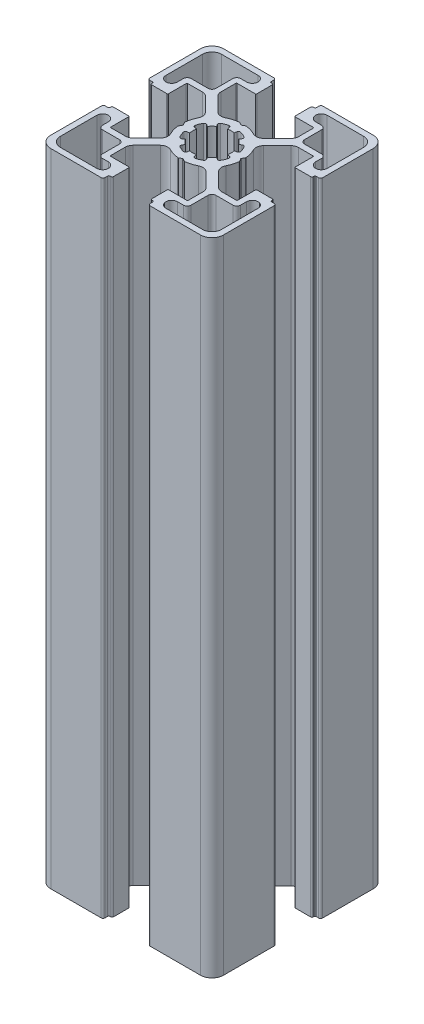
from build123d import *

# Parameters (mm, degrees)
BOSS_EXTRUDE1_DEPTH = 167


with BuildPart() as part:
    # Sketch1 → Boss-Extrude1 (new body)
    with BuildSketch(Plane(origin=(0, 0, 0), x_dir=(1, 0, 0), z_dir=(0, 1, 0))):
        with BuildLine():
            Line((7.563483841, 5.858695924), (11.129779796, 9.424987881))
            ThreePointArc((11.129779796, 9.424987881), (11.76062452, 9.846504465), (12.504756421, 9.994521395))
            Line((12.504756421, 9.994521395), (16.316902359, 9.994521395))
            ThreePointArc((16.316902359, 9.994521395), (16.458323963, 9.935942648), (16.51690271, 9.794521044))
            Line((16.51690271, 9.794521044), (16.51690271, 5.20001408))
            ThreePointArc((16.51690271, 5.20001408), (16.575481456, 5.058592476), (16.716903061, 5.000013729))
            Line((16.716903061, 5.000013729), (20.719599813, 5.000013729))
            ThreePointArc((20.719599813, 5.000013729), (20.931731335, 5.087881483), (21.019599089, 5.300013005))
            Line((21.019599089, 5.300013005), (21.019599089, 5.500003954))
            ThreePointArc((21.019599089, 5.500003954), (21.107466988, 5.71213583), (21.319598864, 5.800003729))
            Line((21.319598864, 5.800003729), (21.999979422, 5.800003729))
            ThreePointArc((21.999979422, 5.800003729), (22.353532548, 5.946450229), (22.499979048, 6.300003356))
            Line((22.499979048, 6.300003356), (22.499979048, 19.500015971))
            ThreePointArc((22.499979048, 19.500015971), (21.621300048, 21.62133473), (19.499981289, 22.50001373))
            Line((19.499981289, 22.50001373), (6.37570892, 22.50001373))
            ThreePointArc((6.37570892, 22.50001373), (6.022155794, 22.35356723), (5.875709294, 22.000014103))
            Line((5.875709294, 22.000014103), (5.875709294, 21.300013005))
            ThreePointArc((5.875709294, 21.300013005), (5.78784154, 21.087881482), (5.575710018, 21.000013729))
            Line((5.575710018, 21.000013729), (5.299998684, 21.000013729))
            ThreePointArc((5.299998684, 21.000013729), (5.087867516, 20.912146122), (4.999999909, 20.700014953))
            Line((4.999999909, 20.700014953), (4.999999909, 16.666812288))
            ThreePointArc((4.999999909, 16.666812288), (5.058578802, 16.52539033), (5.20000076, 16.466811437))
            Line((5.20000076, 16.466811437), (9.905385127, 16.466811437))
            ThreePointArc((9.905385127, 16.466811437), (10.046806731, 16.408232691), (10.105385478, 16.266811086))
            Line((10.105385478, 16.266811086), (10.105385478, 12.471582811))
            ThreePointArc((10.105385478, 12.471582811), (9.953144497, 11.706215717), (9.519598864, 11.057368824))
            Line((9.519598864, 11.057368824), (5.944897897, 7.482667857))
            ThreePointArc((5.944897897, 7.482667857), (4.854602604, 6.96783564), (3.666501718, 7.17329201))
            ThreePointArc((3.666501718, 7.17329201), (2.308631207, 7.714000899), (0.875344921, 8.000128222))
            ThreePointArc((0.875344921, 8.000128222), (0.813048151, 7.996979672), (0.754751151, 7.974792726))
            Line((0.754751151, 7.974792726), (0.112630526, 7.606936313))
            ThreePointArc((0.112630526, 7.606936313), (0.062965968, 7.559088119), (2.065e-06, 7.530953356))
            ThreePointArc((2.065e-06, 7.530953356), (-0.062961837, 7.559088119), (-0.112626394, 7.606936313))
            Line((-0.112626394, 7.606936313), (-0.754745572, 7.974791896))
            ThreePointArc((-0.754745572, 7.974791896), (-0.813042564, 7.99697884), (-0.875339325, 8.000127394))
            ThreePointArc((-0.875339325, 8.000127394), (-2.308625867, 7.714000103), (-3.666496612, 7.173291142))
            ThreePointArc((-3.666496612, 7.173291142), (-4.854599203, 6.967834938), (-5.944895348, 7.482669215))
            Line((-5.944895348, 7.482669215), (-9.519596331, 11.057370197))
            ThreePointArc((-9.519596331, 11.057370197), (-9.953141964, 11.70621709), (-10.105382945, 12.471584185))
            Line((-10.105382945, 12.471584185), (-10.105382945, 16.266811086))
            ThreePointArc((-10.105382945, 16.266811086), (-10.046804198, 16.408232691), (-9.905382594, 16.466811437))
            Line((-9.905382594, 16.466811437), (-5.200000942, 16.466811437))
            ThreePointArc((-5.200000942, 16.466811437), (-5.058578984, 16.52539033), (-5.000000091, 16.666812288))
            Line((-5.000000091, 16.666812288), (-5.000000091, 20.700014953))
            ThreePointArc((-5.000000091, 20.700014953), (-5.087867699, 20.912146122), (-5.299998867, 21.000013729))
            Line((-5.299998867, 21.000013729), (-5.575710202, 21.000013729))
            ThreePointArc((-5.575710202, 21.000013729), (-5.787841724, 21.087881482), (-5.875709478, 21.300013005))
            Line((-5.875709478, 21.300013005), (-5.875709478, 22.000014104))
            ThreePointArc((-5.875709478, 22.000014104), (-6.022155978, 22.35356723), (-6.375709104, 22.50001373))
            Line((-6.375709104, 22.50001373), (-19.499981473, 22.50001373))
            ThreePointArc((-19.499981473, 22.50001373), (-21.621300232, 21.62133473), (-22.499979232, 19.500015971))
            Line((-22.499979232, 19.500015971), (-22.499979232, 6.300003356))
            ThreePointArc((-22.499979232, 6.300003356), (-22.353532732, 5.946450229), (-21.999979605, 5.800003729))
            Line((-21.999979605, 5.800003729), (-21.319599047, 5.800003729))
            ThreePointArc((-21.319599047, 5.800003729), (-21.107467171, 5.71213583), (-21.019599271, 5.500003954))
            Line((-21.019599271, 5.500003954), (-21.019599271, 5.300013005))
            ThreePointArc((-21.019599271, 5.300013005), (-20.931731518, 5.087881483), (-20.719599995, 5.000013729))
            Line((-20.719599995, 5.000013729), (-16.716903244, 5.000013729))
            ThreePointArc((-16.716903244, 5.000013729), (-16.57548164, 5.058592476), (-16.516902894, 5.20001408))
            Line((-16.516902894, 5.20001408), (-16.516902894, 9.794521044))
            ThreePointArc((-16.516902894, 9.794521044), (-16.458324147, 9.935942648), (-16.316902543, 9.994521395))
            Line((-16.316902543, 9.994521395), (-12.504755574, 9.994521395))
            ThreePointArc((-12.504755574, 9.994521395), (-11.760623673, 9.846504465), (-11.129778949, 9.424987881))
            Line((-11.129778949, 9.424987881), (-7.563484024, 5.858696956))
            ThreePointArc((-7.563484024, 5.858696956), (-7.018857309, 4.793955357), (-7.200363541, 3.611860429))
            ThreePointArc((-7.200363541, 3.611860429), (-7.719534914, 2.299057702), (-7.999860794, 0.915436613))
            ThreePointArc((-7.999860794, 0.915436613), (-7.996805132, 0.851929863), (-7.97397167, 0.792591196))
            Line((-7.97397167, 0.792591196), (-7.540055962, 0.046829926))
            ThreePointArc((-7.540055962, 0.046829926), (-7.534291471, 0.023676009), (-7.531325428, 3.7e-07))
            ThreePointArc((-7.531325428, 3.7e-07), (-7.534291471, -0.023675268), (-7.540055962, -0.046829185))
            Line((-7.540055962, -0.046829185), (-7.97397167, -0.792590455))
            ThreePointArc((-7.97397167, -0.792590455), (-7.996805132, -0.851929122), (-7.999860794, -0.915435872))
            ThreePointArc((-7.999860794, -0.915435872), (-7.719534914, -2.299056961), (-7.200363541, -3.611859688))
            ThreePointArc((-7.200363541, -3.611859688), (-7.018857309, -4.793954616), (-7.563484024, -5.858696215))
            Line((-7.563484024, -5.858696215), (-11.12977998, -9.424988171))
            ThreePointArc((-11.12977998, -9.424988171), (-11.760624704, -9.846504756), (-12.504756605, -9.994521685))
            Line((-12.504756605, -9.994521685), (-16.316902543, -9.994521685))
            ThreePointArc((-16.316902543, -9.994521685), (-16.458324147, -9.935942938), (-16.516902894, -9.794521334))
            Line((-16.516902894, -9.794521334), (-16.516902894, -5.200014371))
            ThreePointArc((-16.516902894, -5.200014371), (-16.57548164, -5.058592767), (-16.716903244, -5.000014021))
            Line((-16.716903244, -5.000014021), (-20.719599995, -5.000014021))
            ThreePointArc((-20.719599995, -5.000014021), (-20.931731518, -5.087881774), (-21.019599271, -5.300013296))
            Line((-21.019599271, -5.300013296), (-21.019599271, -5.500004245))
            ThreePointArc((-21.019599271, -5.500004245), (-21.107467171, -5.71213612), (-21.319599047, -5.80000402))
            Line((-21.319599047, -5.80000402), (-21.999979605, -5.80000402))
            ThreePointArc((-21.999979605, -5.80000402), (-22.353532732, -5.94645052), (-22.499979232, -6.300003647))
            Line((-22.499979232, -6.300003647), (-22.499979232, -19.500016261))
            ThreePointArc((-22.499979232, -19.500016261), (-21.621300232, -21.62133502), (-19.499981473, -22.50001402))
            Line((-19.499981473, -22.50001402), (-6.375709104, -22.50001402))
            ThreePointArc((-6.375709104, -22.50001402), (-6.022155978, -22.35356752), (-5.875709478, -22.000014394))
            Line((-5.875709478, -22.000014394), (-5.875709478, -21.300013295))
            ThreePointArc((-5.875709478, -21.300013295), (-5.787841724, -21.087881773), (-5.575710202, -21.000014019))
            Line((-5.575710202, -21.000014019), (-5.299998867, -21.000014019))
            ThreePointArc((-5.299998867, -21.000014019), (-5.087867699, -20.912146412), (-5.000000091, -20.700015244))
            Line((-5.000000091, -20.700015244), (-5.000000091, -16.666812578))
            ThreePointArc((-5.000000091, -16.666812578), (-5.058578984, -16.52539062), (-5.200000942, -16.466811727))
            Line((-5.200000942, -16.466811727), (-9.905382594, -16.466811727))
            ThreePointArc((-9.905382594, -16.466811727), (-10.046804198, -16.40823298), (-10.105382945, -16.266811376))
            Line((-10.105382945, -16.266811376), (-10.105382945, -12.471581681))
            ThreePointArc((-10.105382945, -12.471581681), (-9.953141964, -11.706214586), (-9.519596331, -11.057367693))
            Line((-9.519596331, -11.057367693), (-5.944895364, -7.482666726))
            ThreePointArc((-5.944895364, -7.482666726), (-4.854601518, -6.967832762), (-3.66650075, -7.173286521))
            ThreePointArc((-3.66650075, -7.173286521), (-2.30862839, -7.713996836), (-0.875339942, -8.000124808))
            ThreePointArc((-0.875339942, -8.000124808), (-0.81304361, -7.99697628), (-0.754747019, -7.97478949))
            Line((-0.754747019, -7.97478949), (-0.112626395, -7.606933078))
            ThreePointArc((-0.112626395, -7.606933078), (-0.062961838, -7.559084884), (2.065e-06, -7.530950121))
            ThreePointArc((2.065e-06, -7.530950121), (0.062965968, -7.559084884), (0.112630526, -7.606933078))
            Line((0.112630526, -7.606933078), (0.754751151, -7.974789491))
            ThreePointArc((0.754751151, -7.974789491), (0.813048151, -7.996976437), (0.875344921, -8.000124987))
            ThreePointArc((0.875344921, -8.000124987), (2.308629801, -7.71399808), (3.666499103, -7.173290103))
            ThreePointArc((3.666499103, -7.173290103), (4.854601719, -6.967833865), (5.944897897, -7.482668146))
            Line((5.944897897, -7.482668146), (9.519598864, -11.057369113))
            ThreePointArc((9.519598864, -11.057369113), (9.953144497, -11.706216006), (10.105385478, -12.471583101))
            Line((10.105385478, -12.471583101), (10.105385478, -16.266811376))
            ThreePointArc((10.105385478, -16.266811376), (10.046806731, -16.40823298), (9.905385127, -16.466811727))
            Line((9.905385127, -16.466811727), (5.20000076, -16.466811727))
            ThreePointArc((5.20000076, -16.466811727), (5.058578802, -16.52539062), (4.999999909, -16.666812578))
            Line((4.999999909, -16.666812578), (4.999999909, -20.700015244))
            ThreePointArc((4.999999909, -20.700015244), (5.087867516, -20.912146412), (5.299998684, -21.000014019))
            Line((5.299998684, -21.000014019), (5.575710018, -21.000014019))
            ThreePointArc((5.575710018, -21.000014019), (5.78784154, -21.087881773), (5.875709294, -21.300013295))
            Line((5.875709294, -21.300013295), (5.875709294, -22.000014394))
            ThreePointArc((5.875709294, -22.000014394), (6.022155794, -22.35356752), (6.37570892, -22.50001402))
            Line((6.37570892, -22.50001402), (19.499981289, -22.50001402))
            ThreePointArc((19.499981289, -22.50001402), (21.621300048, -21.62133502), (22.499979048, -19.500016261))
            Line((22.499979048, -19.500016261), (22.499979048, -6.300003646))
            ThreePointArc((22.499979048, -6.300003646), (22.353532548, -5.94645052), (21.999979422, -5.80000402))
            Line((21.999979422, -5.80000402), (21.319598864, -5.80000402))
            ThreePointArc((21.319598864, -5.80000402), (21.107466988, -5.71213612), (21.019599089, -5.500004245))
            Line((21.019599089, -5.500004245), (21.019599089, -5.300013297))
            ThreePointArc((21.019599089, -5.300013297), (20.931731335, -5.087881774), (20.719599813, -5.000014021))
            Line((20.719599813, -5.000014021), (16.716903061, -5.000014021))
            ThreePointArc((16.716903061, -5.000014021), (16.575481456, -5.058592767), (16.51690271, -5.200014371))
            Line((16.51690271, -5.200014371), (16.51690271, -9.794521334))
            ThreePointArc((16.51690271, -9.794521334), (16.458323963, -9.935942938), (16.316902359, -9.994521685))
            Line((16.316902359, -9.994521685), (12.504756421, -9.994521685))
            ThreePointArc((12.504756421, -9.994521685), (11.76062452, -9.846504756), (11.129779797, -9.424988171))
            Line((11.129779797, -9.424988171), (7.56348384, -5.858696215))
            ThreePointArc((7.56348384, -5.858696215), (7.018857125, -4.793954616), (7.200363357, -3.611859689))
            ThreePointArc((7.200363357, -3.611859689), (7.71953473, -2.299056961), (7.99986061, -0.915435872))
            ThreePointArc((7.99986061, -0.915435872), (7.996804948, -0.851929122), (7.973971486, -0.792590456))
            Line((7.973971486, -0.792590456), (7.54005578, -0.046829188))
            ThreePointArc((7.54005578, -0.046829188), (7.53429135, -0.023675779), (7.531325245, -6.6e-07))
            ThreePointArc((7.531325245, -6.6e-07), (7.534291289, 0.023674979), (7.54005578, 0.046828898))
            Line((7.54005578, 0.046828898), (7.973971486, 0.792590166))
            ThreePointArc((7.973971486, 0.792590166), (7.996804949, 0.851928832), (7.99986061, 0.915435582))
            ThreePointArc((7.99986061, 0.915435582), (7.719534731, 2.299056671), (7.200363358, 3.611859399))
            ThreePointArc((7.200363358, 3.611859399), (7.018857126, 4.793954326), (7.563483841, 5.858695924))
        make_face()
        with BuildLine():
            Line((-17.99997923, 9.000204729), (-17.99997923, 10.550013476))
            ThreePointArc((-17.99997923, 10.550013476), (-17.70708623, 11.257119729), (-16.999979977, 11.550012729))
            Line((-16.999979977, 11.550012729), (-12.549977483, 11.550012729))
            ThreePointArc((-12.549977483, 11.550012729), (-11.84287123, 11.842905729), (-11.54997823, 12.550011982))
            Line((-11.54997823, 12.550011982), (-11.54997823, 17.000014476))
            ThreePointArc((-11.54997823, 17.000014476), (-11.25708523, 17.707120729), (-10.549978977, 18.000013729))
            Line((-10.549978977, 18.000013729), (-8.99997923, 18.000013729))
            ThreePointArc((-8.99997923, 18.000013729), (-7.49997923, 19.500013729), (-8.99997923, 21.000013729))
            Line((-8.99997923, 21.000013729), (-18.499981098, 21.000013729))
            ThreePointArc((-18.499981098, 21.000013729), (-20.26774673, 20.267781229), (-20.99997923, 18.500015597))
            Line((-20.99997923, 18.500015597), (-20.99997923, 9.000204729))
            ThreePointArc((-20.99997923, 9.000204729), (-19.49997923, 7.500204729), (-17.99997923, 9.000204729))
        make_face(mode=Mode.SUBTRACT)
        with BuildLine():
            Line((0.967518273, 5.481094418), (0.867385333, 4.924170439))
            ThreePointArc((0.867385333, 4.924170439), (-3.404e-06, 4.999981493), (-0.867392141, 4.924170439))
            Line((-0.867392141, 4.924170439), (-0.967525085, 5.48109443))
            ThreePointArc((-0.967525085, 5.48109443), (-1.18787304, 5.829596016), (-1.595121059, 5.894060173))
            ThreePointArc((-1.595121059, 5.894060173), (-2.337474987, 5.644060679), (-3.0416713, 5.300991221))
            ThreePointArc((-3.0416713, 5.300991221), (-3.284300912, 4.965857552), (-3.191387249, 4.562681715))
            Line((-3.191387249, 4.562681715), (-2.864003826, 4.098457013))
            ThreePointArc((-2.864003826, 4.098457013), (-3.530136355, 3.540908116), (-4.089716295, 2.876480837))
            Line((-4.089716295, 2.876480837), (-4.566781049, 3.208143991))
            ThreePointArc((-4.566781049, 3.208143991), (-4.968981864, 3.298752353), (-5.302521511, 3.056416481))
            ThreePointArc((-5.302521511, 3.056416481), (-5.650679971, 2.354692469), (-5.906040083, 1.614137194))
            ThreePointArc((-5.906040083, 1.614137194), (-5.840630787, 1.205603075), (-5.48985103, 0.986212864))
            Line((-5.48985103, 0.986212864), (-4.920549171, 0.887804317))
            ThreePointArc((-4.920549171, 0.887804317), (-5.000003405, -1.8509e-05), (-4.92054917, -0.887841334))
            Line((-4.92054917, -0.887841334), (-5.48973413, -0.986229672))
            ThreePointArc((-5.48973413, -0.986229672), (-5.84059179, -1.205595835), (-5.906027737, -1.614179668))
            ThreePointArc((-5.906027737, -1.614179668), (-5.650660878, -2.354735576), (-5.302495324, -3.056459191))
            ThreePointArc((-5.302495324, -3.056459191), (-4.968965627, -3.298777294), (-4.566781049, -3.208181006))
            Line((-4.566781049, -3.208181006), (-4.089716295, -2.876517852))
            ThreePointArc((-4.089716295, -2.876517852), (-3.530136355, -3.540945131), (-2.864003826, -4.098494028))
            Line((-2.864003826, -4.098494028), (-3.191315305, -4.562616715))
            ThreePointArc((-3.191315305, -4.562616715), (-3.284288314, -4.9658247), (-3.041645074, -5.301003633))
            ThreePointArc((-3.041645074, -5.301003633), (-2.337436005, -5.644074141), (-1.595068803, -5.894071587))
            ThreePointArc((-1.595068803, -5.894071587), (-1.187863583, -5.829591875), (-0.967525085, -5.481131446))
            Line((-0.967525085, -5.481131446), (-0.867392142, -4.924207454))
            ThreePointArc((-0.867392142, -4.924207454), (-3.405e-06, -5.000018508), (0.867385333, -4.924207454))
            Line((0.867385333, -4.924207454), (0.967518273, -5.481131433))
            ThreePointArc((0.967518273, -5.481131433), (1.187884068, -5.829612183), (1.595127065, -5.894056407))
            ThreePointArc((1.595127065, -5.894056407), (2.337463214, -5.64406402), (3.04164388, -5.301006091))
            ThreePointArc((3.04164388, -5.301006091), (3.284272431, -4.965888777), (3.191382531, -4.562721697))
            Line((3.191382531, -4.562721697), (2.863997017, -4.098494027))
            ThreePointArc((2.863997017, -4.098494027), (3.530129546, -3.540945131), (4.089709486, -2.876517851))
            Line((4.089709486, -2.876517851), (4.56677425, -3.208181013))
            ThreePointArc((4.56677425, -3.208181013), (4.968991235, -3.298778206), (5.302526078, -3.056413061))
            ThreePointArc((5.302526078, -3.056413061), (5.650679647, -2.354700627), (5.90603791, -1.614157983))
            ThreePointArc((5.90603791, -1.614157983), (5.840629826, -1.205623017), (5.489849863, -0.98623192))
            Line((5.489849863, -0.98623192), (4.920545674, -0.88782297))
            ThreePointArc((4.920545674, -0.88782297), (4.999996595, -1.94e-07), (4.92053917, 0.887822))
            Line((4.92053917, 0.887822), (5.489724104, 0.986210336))
            ThreePointArc((5.489724104, 0.986210336), (5.840595493, 1.20557008), (5.90603791, 1.614161218))
            ThreePointArc((5.90603791, 1.614161218), (5.650669489, 2.354728137), (5.302499707, 3.056461843))
            ThreePointArc((5.302499707, 3.056461843), (4.968955649, 3.298763634), (4.56677425, 3.208143998))
            Line((4.56677425, 3.208143998), (4.089709486, 2.876480836))
            ThreePointArc((4.089709486, 2.876480836), (3.530129546, 3.540908115), (2.863997017, 4.098457012))
            Line((2.863997017, 4.098457012), (3.191308496, 4.562579701))
            ThreePointArc((3.191308496, 4.562579701), (3.284310107, 4.965799272), (3.041663899, 5.300997928))
            ThreePointArc((3.041663899, 5.300997928), (2.337448292, 5.644073372), (1.595073641, 5.894073887))
            ThreePointArc((1.595073641, 5.894073887), (1.18784779, 5.829586125), (0.967518273, 5.481094418))
        make_face(mode=Mode.SUBTRACT)
        with BuildLine():
            Line((-20.99997923, -9.000205019), (-20.99997923, -18.500015887))
            ThreePointArc((-20.99997923, -18.500015887), (-20.26774673, -20.267781519), (-18.499981098, -21.000014019))
            Line((-18.499981098, -21.000014019), (-8.99997923, -21.000014019))
            ThreePointArc((-8.99997923, -21.000014019), (-7.49997923, -19.500014019), (-8.99997923, -18.000014019))
            Line((-8.99997923, -18.000014019), (-10.549978977, -18.000014019))
            ThreePointArc((-10.549978977, -18.000014019), (-11.25708523, -17.707121019), (-11.54997823, -17.000014766))
            Line((-11.54997823, -17.000014766), (-11.54997823, -12.550012272))
            ThreePointArc((-11.54997823, -12.550012272), (-11.84287123, -11.842906019), (-12.549977483, -11.550013019))
            Line((-12.549977483, -11.550013019), (-16.999979977, -11.550013019))
            ThreePointArc((-16.999979977, -11.550013019), (-17.70708623, -11.257120019), (-17.99997923, -10.550013766))
            Line((-17.99997923, -10.550013766), (-17.99997923, -9.000205019))
            ThreePointArc((-17.99997923, -9.000205019), (-19.49997923, -7.500205019), (-20.99997923, -9.000205019))
        make_face(mode=Mode.SUBTRACT)
        with BuildLine():
            Line((20.999979046, 9.000204729), (20.999979046, 18.500015597))
            ThreePointArc((20.999979046, 18.500015597), (20.267746546, 20.267781229), (18.499980914, 21.000013729))
            Line((18.499980914, 21.000013729), (8.999979046, 21.000013729))
            ThreePointArc((8.999979046, 21.000013729), (7.499979046, 19.500013729), (8.999979046, 18.000013729))
            Line((8.999979046, 18.000013729), (10.549978793, 18.000013729))
            ThreePointArc((10.549978793, 18.000013729), (11.257085046, 17.707120729), (11.549978046, 17.000014476))
            Line((11.549978046, 17.000014476), (11.549978046, 12.550011982))
            ThreePointArc((11.549978046, 12.550011982), (11.842871046, 11.842905729), (12.549977299, 11.550012729))
            Line((12.549977299, 11.550012729), (16.999979793, 11.550012729))
            ThreePointArc((16.999979793, 11.550012729), (17.707086046, 11.257119729), (17.999979046, 10.550013476))
            Line((17.999979046, 10.550013476), (17.999979046, 9.000204729))
            ThreePointArc((17.999979046, 9.000204729), (19.499979046, 7.500204729), (20.999979046, 9.000204729))
        make_face(mode=Mode.SUBTRACT)
        with BuildLine():
            Line((16.999979793, -11.550013019), (12.549977299, -11.550013019))
            ThreePointArc((12.549977299, -11.550013019), (11.842871046, -11.842906019), (11.549978046, -12.550012272))
            Line((11.549978046, -12.550012272), (11.549978046, -17.000014766))
            ThreePointArc((11.549978046, -17.000014766), (11.257085046, -17.707121019), (10.549978793, -18.000014019))
            Line((10.549978793, -18.000014019), (8.999979046, -18.000014019))
            ThreePointArc((8.999979046, -18.000014019), (7.499979046, -19.500014019), (8.999979046, -21.000014019))
            Line((8.999979046, -21.000014019), (18.499980914, -21.000014019))
            ThreePointArc((18.499980914, -21.000014019), (20.267746546, -20.267781519), (20.999979046, -18.500015887))
            Line((20.999979046, -18.500015887), (20.999979046, -9.000205019))
            ThreePointArc((20.999979046, -9.000205019), (19.499979046, -7.500205019), (17.999979046, -9.000205019))
            Line((17.999979046, -9.000205019), (17.999979046, -10.550013766))
            ThreePointArc((17.999979046, -10.550013766), (17.707086046, -11.257120019), (16.999979793, -11.550013019))
        make_face(mode=Mode.SUBTRACT)
    extrude(amount=BOSS_EXTRUDE1_DEPTH)


solid = part.part
